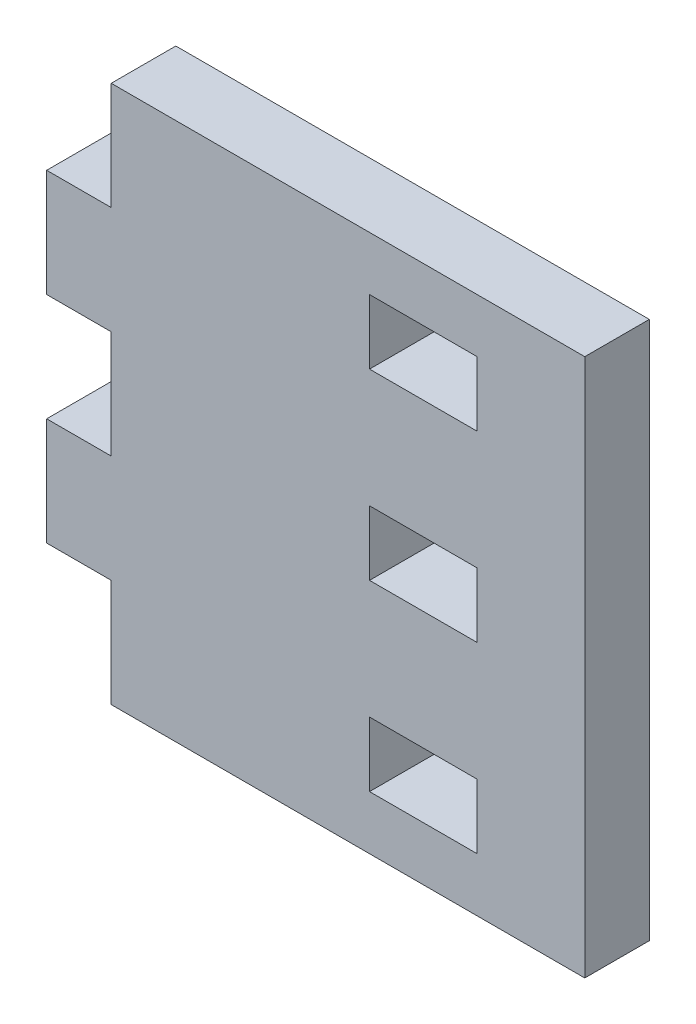
from build123d import *

# Parameters (mm, degrees)
SKETCH_1_W      = 10
SKETCH_1_H      = 6
EXTRUDE_1_DEPTH = 6


with BuildPart() as part:
    # 草圖1 → 填料-伸長1 (new body)
    with BuildSketch(Plane.XY):
        Polygon((-33.45, 18.7375), (-33.45, 8.7375), (-27.45, 8.7375), (-27.45, -1.2625), (-33.45, -1.2625), (-33.45, -11.2625), (-27.45, -11.2625), (-27.45, -21.2625), (16.55, -21.2625), (16.55, 28.7375), (-27.45, 28.7375), (-27.45, 18.7375), align=None)
        with Locations((1.55, -13.2625)):
            Rectangle(SKETCH_1_W, SKETCH_1_H, mode=Mode.SUBTRACT)
        with Locations((1.55, 3.7375)):
            Rectangle(SKETCH_1_W, SKETCH_1_H, mode=Mode.SUBTRACT)
        with Locations((1.55, 20.7375)):
            Rectangle(SKETCH_1_W, SKETCH_1_H, mode=Mode.SUBTRACT)
    extrude(amount=EXTRUDE_1_DEPTH)


solid = part.part
